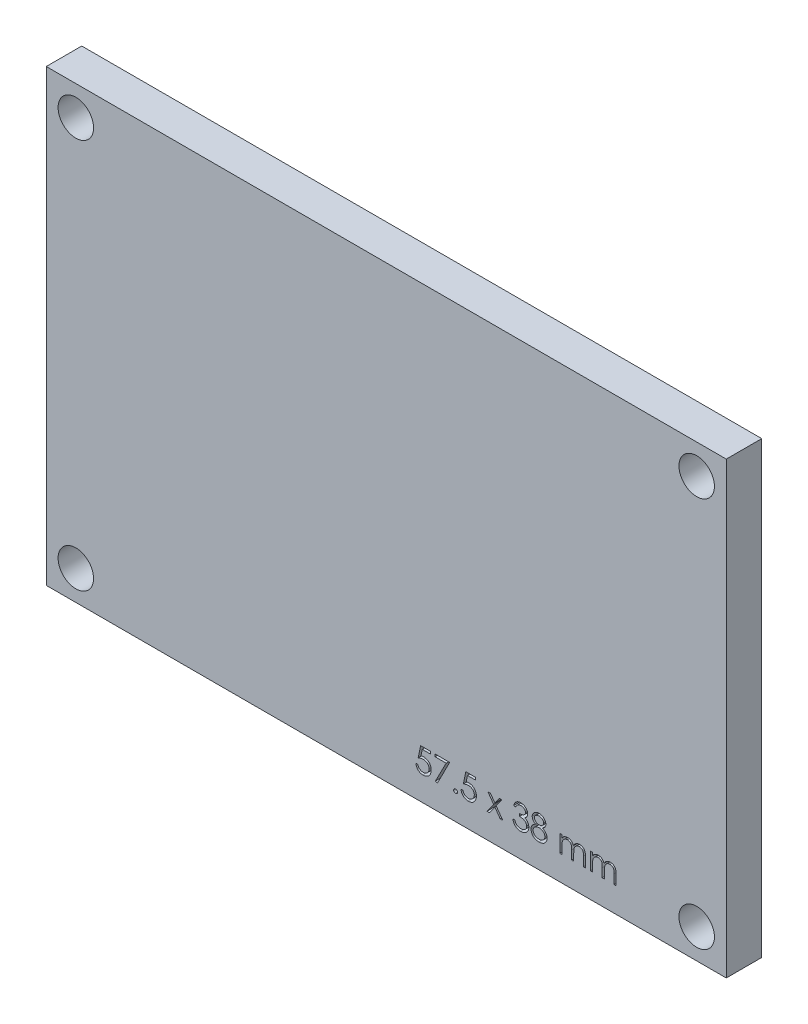
from build123d import *

# Parameters (mm, degrees)
SKETCH1_W               = 57.5
SKETCH1_H               = 38
BOSS_EXTRUDE1_DEPTH     = 3
CUT_EXTRUDE1_DEPTH      = 35.591364529
CUT_EXTRUDE1_DEPTH_BACK = 35.591364529
SKETCH2_R               = 1.5
CUT_EXTRUDE2_DEPTH      = 1


with BuildPart() as part:
    # Sketch1 → Boss-Extrude1 (new body)
    with BuildSketch(Plane.XY):
        Rectangle(SKETCH1_W, SKETCH1_H)
    extrude(amount=BOSS_EXTRUDE1_DEPTH)

    # Sketch2 → Cut-Extrude1 (cut, two sides: drawn at the far end of the back side and taken through both)
    with BuildSketch(Plane.XY.offset(3).offset(-CUT_EXTRUDE1_DEPTH_BACK)):
        with Locations((-26.25, 16.5)):
            Circle(SKETCH2_R)
        with Locations((-26.25, -16.5)):
            Circle(SKETCH2_R)
        with Locations((26.25, 16.5)):
            Circle(SKETCH2_R)
        with Locations((26.25, -16.5)):
            Circle(SKETCH2_R)
    extrude(amount=CUT_EXTRUDE1_DEPTH + CUT_EXTRUDE1_DEPTH_BACK, mode=Mode.SUBTRACT)

    # Sketch4 → Cut-Extrude2 (cut)
    # profile 1 of 9: a face of its own
    with BuildSketch(Plane.XY.offset(3)):
        with BuildLine():
            Line((3.724840793, -14.904911139), (3.724840793, -15.110039344))
            Line((3.724840793, -15.110039344), (3.044552332, -15.110039344))
            Line((3.044552332, -15.110039344), (2.936779896, -15.636081011))
            add(Edge.make_bspline(
                [(2.936779896, -15.636081011), (2.957954681, -15.630235141), (2.998977479, -15.618909693), (3.059525971, -15.606334967), (3.11700723, -15.598754714), (3.154307441, -15.597719679), (3.172356819, -15.597218831)],
                knots=[0, 0, 0, 0, 1.100273476, 2.13160584, 3.095893838, 4, 4, 4, 4], degree=3))
            add(Edge.make_bspline(
                [(3.172356819, -15.597218831), (3.194690384, -15.597702223), (3.238603754, -15.598652692), (3.302854581, -15.607779463), (3.364187663, -15.622145129), (3.422474732, -15.642213998), (3.477823618, -15.667876703), (3.529725081, -15.699933812), (3.578958174, -15.73738143), (3.624639657, -15.780435722), (3.666082118, -15.827819503), (3.702519827, -15.878766858), (3.733469878, -15.932782665), (3.758361738, -15.990383013), (3.778238501, -16.0509311), (3.791468212, -16.115064005), (3.80027776, -16.182177216), (3.801261981, -16.228065542), (3.80176387, -16.251465626)],
                knots=[0, 0, 0, 0, 1.052922333, 2.070308379, 3.05430497, 4.020497103, 4.973039431, 5.925935799, 6.892292201, 7.88610001, 8.88166317, 9.857072816, 10.836096531, 11.812156883, 12.81219415, 13.836441305, 14.89672472, 16, 16, 16, 16], degree=3))
            add(Edge.make_bspline(
                [(3.80176387, -16.251465626), (3.801383827, -16.267764038), (3.800628877, -16.300140602), (3.796789684, -16.348223002), (3.789397846, -16.395287479), (3.779473432, -16.441340274), (3.766592051, -16.486294201), (3.750998306, -16.530277931), (3.731914861, -16.573017706), (3.710982647, -16.614917932), (3.687413231, -16.655031365), (3.661254084, -16.692545071), (3.63361666, -16.728021804), (3.603878726, -16.76108108), (3.571763871, -16.791505661), (3.537661033, -16.819476108), (3.501842337, -16.845465439), (3.463753627, -16.868418694), (3.424243636, -16.889540383), (3.382741798, -16.906868119), (3.340192826, -16.922359849), (3.295984326, -16.934708151), (3.250216433, -16.944383896), (3.202813704, -16.950955668), (3.15402475, -16.955742203), (3.120953314, -16.956041836), (3.104247844, -16.95619319)],
                knots=[0, 0, 0, 0, 1.056347294, 2.098418968, 3.122841568, 4.141288669, 5.149314143, 6.15115421, 7.162517403, 8.180376062, 9.185164535, 10.17417709, 11.141909838, 12.097768115, 13.052685741, 14.0056014, 14.954263652, 15.917497458, 16.885230207, 17.854509472, 18.828990115, 19.81800267, 20.826176721, 21.857883937, 22.917946725, 24, 24, 24, 24], degree=3))
            add(Edge.make_bspline(
                [(3.104247844, -16.95619319), (3.084319741, -16.955798426), (3.045113552, -16.955021773), (2.987673228, -16.946896924), (2.932407739, -16.935260401), (2.879761967, -16.917753961), (2.829264102, -16.895818364), (2.781593978, -16.868094837), (2.735533534, -16.836678206), (2.692955227, -16.799603719), (2.653437448, -16.759080472), (2.6180623, -16.715104677), (2.586557399, -16.668402139), (2.559427258, -16.618746051), (2.536285532, -16.56626689), (2.518105538, -16.510768033), (2.503432193, -16.452539459), (2.497224524, -16.412451739), (2.494071562, -16.392090626)],
                knots=[0, 0, 0, 0, 1.0467383, 2.05933395, 3.04377827, 4.011590433, 4.970194871, 5.932262533, 6.905835911, 7.896367577, 8.894135286, 9.877477877, 10.858688626, 11.851381753, 12.8477658, 13.868841284, 14.917554742, 16, 16, 16, 16], degree=3))
            Line((2.494071562, -16.392090626), (2.673558742, -16.392090626))
            add(Edge.make_bspline(
                [(2.673558742, -16.392090626), (2.67797506, -16.411162885), (2.68646347, -16.447820825), (2.705095326, -16.499324448), (2.727875826, -16.545221147), (2.754964025, -16.586118052), (2.787278329, -16.621780336), (2.824152288, -16.653561515), (2.865493844, -16.682233017), (2.911432832, -16.706131741), (2.959897449, -16.726513886), (3.010621569, -16.740086283), (3.062224053, -16.74962965), (3.097125979, -16.750584942), (3.114664511, -16.751064985)],
                knots=[0, 0, 0, 0, 1.136247022, 2.183929868, 3.172523383, 4.106158343, 5.02341133, 5.958108904, 6.928429099, 7.938127109, 8.96079061, 9.975095812, 10.982467395, 12, 12, 12, 12], degree=3))
            add(Edge.make_bspline(
                [(3.114664511, -16.751064985), (3.131783622, -16.750595969), (3.165491292, -16.749672473), (3.215097799, -16.742564466), (3.26299087, -16.731617282), (3.308697931, -16.715234508), (3.35301881, -16.69532324), (3.394832393, -16.669771769), (3.435348323, -16.640366044), (3.473307257, -16.606676541), (3.508072656, -16.569551001), (3.53879044, -16.529849633), (3.564377247, -16.48749715), (3.585939595, -16.443226777), (3.602312909, -16.396553315), (3.61399347, -16.347695501), (3.62085236, -16.296532655), (3.621795892, -16.261635907), (3.62227669, -16.243853447)],
                knots=[0, 0, 0, 0, 1.027316725, 2.022795036, 3.002884548, 3.971462791, 4.93288096, 5.914575861, 6.907176829, 7.935150275, 8.956128384, 9.956726525, 10.942570165, 11.921478529, 12.907843606, 13.90538589, 14.932640048, 16, 16, 16, 16], degree=3))
            add(Edge.make_bspline(
                [(3.62227669, -16.243853447), (3.621900417, -16.22781016), (3.621163914, -16.196407709), (3.615146445, -16.150465305), (3.604679604, -16.106994996), (3.590151672, -16.065786862), (3.571706239, -16.026802038), (3.549165489, -15.990000289), (3.522106405, -15.95586667), (3.491196754, -15.924385211), (3.457335017, -15.895330997), (3.419938592, -15.870562947), (3.379790063, -15.849726423), (3.337373149, -15.831744709), (3.291678921, -15.818829998), (3.243612274, -15.809134063), (3.192654155, -15.803525285), (3.157813762, -15.802747063), (3.139904896, -15.802347036)],
                knots=[0, 0, 0, 0, 1.045622112, 2.046656509, 3.013763289, 3.955457236, 4.890082067, 5.820317437, 6.762574623, 7.722996705, 8.69280354, 9.665887285, 10.63943826, 11.638615906, 12.663482002, 13.728887084, 14.832589034, 16, 16, 16, 16], degree=3))
            add(Edge.make_bspline(
                [(3.139904896, -15.802347036), (3.124402651, -15.802678803), (3.092394448, -15.803363816), (3.043295689, -15.808407529), (2.991700419, -15.816544268), (2.937806422, -15.82773641), (2.881451846, -15.842382739), (2.822755617, -15.859933882), (2.761594321, -15.880917882), (2.720384193, -15.896764861), (2.699199767, -15.904911139)],
                knots=[0, 0, 0, 0, 0.817624296, 1.688186739, 2.600797293, 3.572016777, 4.590301741, 5.671205678, 6.80286297, 8, 8, 8, 8], degree=3))
            Line((2.699199767, -15.904911139), (2.904327973, -14.904911139))
            Line((2.904327973, -14.904911139), (3.724840793, -14.904911139))
        make_face()
    # profile 2 of 9: a face of its own
    with BuildSketch(Plane.XY.offset(3)):
        Polygon((4.135097203, -14.904911139), (5.365866434, -14.904911139), (4.314584383, -16.95619319), (4.159536306, -16.870856652), (5.062180537, -15.110039344), (4.135097203, -15.110039344), align=None)
    # profile 3 of 9: a face of its own
    with BuildSketch(Plane.XY.offset(3)):
        with BuildLine():
            add(Edge.make_bspline(
                [(5.865866434, -16.597218831), (5.877003698, -16.597880641), (5.898837002, -16.599178041), (5.930402219, -16.608078997), (5.958970596, -16.623883946), (5.984417593, -16.644948391), (6.005392722, -16.67048877), (6.021760923, -16.698829289), (6.030584343, -16.730658771), (6.031872293, -16.752618585), (6.032533101, -16.763885498)],
                knots=[0, 0, 0, 0, 1.020151414, 1.999887582, 2.974338812, 3.990962822, 5.007586832, 5.987933904, 6.967670073, 8, 8, 8, 8], degree=3))
            add(Edge.make_bspline(
                [(6.032533101, -16.763885498), (6.0318499, -16.774881686), (6.030502639, -16.796566008), (6.021781149, -16.828155416), (6.005267977, -16.856513647), (5.984562267, -16.882400583), (5.958964305, -16.903509652), (5.930334678, -16.919180134), (5.898911102, -16.928718409), (5.87701606, -16.929933436), (5.865866434, -16.930552165)],
                knots=[0, 0, 0, 0, 1.009421747, 1.99056486, 2.972319754, 3.999869655, 5.017953583, 5.993804169, 6.978383603, 8, 8, 8, 8], degree=3))
            add(Edge.make_bspline(
                [(5.865866434, -16.930552165), (5.854708774, -16.929955823), (5.832926098, -16.928791609), (5.801619816, -16.918984291), (5.772815833, -16.9036566), (5.747222855, -16.882361223), (5.726343729, -16.856646855), (5.710557796, -16.827960114), (5.701077711, -16.796656436), (5.699830926, -16.774899497), (5.699199767, -16.763885498)],
                knots=[0, 0, 0, 0, 1.022052826, 1.995314843, 2.982371812, 4.00089066, 5.028879526, 6.005146991, 6.990147033, 8, 8, 8, 8], degree=3))
            add(Edge.make_bspline(
                [(5.699199767, -16.763885498), (5.699806681, -16.752600138), (5.700991606, -16.730566858), (5.710577698, -16.699024511), (5.726221247, -16.670356831), (5.747367187, -16.644987357), (5.772809642, -16.62373747), (5.801550331, -16.608271874), (5.833001497, -16.599105924), (5.854721461, -16.597858771), (5.865866434, -16.597218831)],
                knots=[0, 0, 0, 0, 1.032775665, 2.016367738, 2.991239715, 4.008302682, 5.025365648, 6.011011707, 6.979408107, 8, 8, 8, 8], degree=3))
        make_face()
    # profile 4 of 9: a face of its own
    with BuildSketch(Plane.XY.offset(3)):
        with BuildLine():
            Line((7.545353614, -14.904911139), (7.545353614, -15.110039344))
            Line((7.545353614, -15.110039344), (6.865065152, -15.110039344))
            Line((6.865065152, -15.110039344), (6.757292716, -15.636081011))
            add(Edge.make_bspline(
                [(6.757292716, -15.636081011), (6.778467501, -15.630235141), (6.819490299, -15.618909693), (6.880038791, -15.606334967), (6.93752005, -15.598754714), (6.974820262, -15.597719679), (6.992869639, -15.597218831)],
                knots=[0, 0, 0, 0, 1.100273476, 2.13160584, 3.095893838, 4, 4, 4, 4], degree=3))
            add(Edge.make_bspline(
                [(6.992869639, -15.597218831), (7.015203205, -15.597702223), (7.059116575, -15.598652692), (7.123367402, -15.607779463), (7.184700483, -15.622145129), (7.242987552, -15.642213998), (7.298336438, -15.667876703), (7.350237902, -15.699933812), (7.399470995, -15.73738143), (7.445152477, -15.780435722), (7.486594939, -15.827819503), (7.523032647, -15.878766858), (7.553982699, -15.932782665), (7.578874559, -15.990383013), (7.598751321, -16.0509311), (7.611981033, -16.115064005), (7.620790581, -16.182177216), (7.621774801, -16.228065542), (7.62227669, -16.251465626)],
                knots=[0, 0, 0, 0, 1.052922333, 2.070308379, 3.05430497, 4.020497103, 4.973039431, 5.925935799, 6.892292201, 7.88610001, 8.88166317, 9.857072816, 10.836096531, 11.812156883, 12.81219415, 13.836441305, 14.89672472, 16, 16, 16, 16], degree=3))
            add(Edge.make_bspline(
                [(7.62227669, -16.251465626), (7.621896647, -16.267764038), (7.621141697, -16.300140602), (7.617302504, -16.348223002), (7.609910667, -16.395287479), (7.599986253, -16.441340274), (7.587104871, -16.486294201), (7.571511126, -16.530277931), (7.552427682, -16.573017706), (7.531495467, -16.614917932), (7.507926051, -16.655031365), (7.481766904, -16.692545071), (7.454129481, -16.728021804), (7.424391546, -16.76108108), (7.392276692, -16.791505661), (7.358173854, -16.819476108), (7.322355157, -16.845465439), (7.284266447, -16.868418694), (7.244756457, -16.889540383), (7.203254619, -16.906868119), (7.160705647, -16.922359849), (7.116497147, -16.934708151), (7.070729254, -16.944383896), (7.023326525, -16.950955668), (6.97453757, -16.955742203), (6.941466135, -16.956041836), (6.924760665, -16.95619319)],
                knots=[0, 0, 0, 0, 1.056347294, 2.098418968, 3.122841568, 4.141288669, 5.149314143, 6.15115421, 7.162517403, 8.180376062, 9.185164535, 10.17417709, 11.141909838, 12.097768115, 13.052685741, 14.0056014, 14.954263652, 15.917497458, 16.885230207, 17.854509472, 18.828990115, 19.81800267, 20.826176721, 21.857883937, 22.917946725, 24, 24, 24, 24], degree=3))
            add(Edge.make_bspline(
                [(6.924760665, -16.95619319), (6.904832562, -16.955798426), (6.865626373, -16.955021773), (6.808186049, -16.946896924), (6.75292056, -16.935260401), (6.700274788, -16.917753961), (6.649776923, -16.895818364), (6.602106798, -16.868094837), (6.556046355, -16.836678206), (6.513468048, -16.799603719), (6.473950269, -16.759080472), (6.438575121, -16.715104677), (6.40707022, -16.668402139), (6.379940079, -16.618746051), (6.356798352, -16.56626689), (6.338618359, -16.510768033), (6.323945013, -16.452539459), (6.317737344, -16.412451739), (6.314584383, -16.392090626)],
                knots=[0, 0, 0, 0, 1.0467383, 2.05933395, 3.04377827, 4.011590433, 4.970194871, 5.932262533, 6.905835911, 7.896367577, 8.894135286, 9.877477877, 10.858688626, 11.851381753, 12.8477658, 13.868841284, 14.917554742, 16, 16, 16, 16], degree=3))
            Line((6.314584383, -16.392090626), (6.494071562, -16.392090626))
            add(Edge.make_bspline(
                [(6.494071562, -16.392090626), (6.498487881, -16.411162885), (6.50697629, -16.447820825), (6.525608147, -16.499324448), (6.548388647, -16.545221147), (6.575476846, -16.586118052), (6.607791149, -16.621780336), (6.644665109, -16.653561515), (6.686006665, -16.682233017), (6.731945653, -16.706131741), (6.78041027, -16.726513886), (6.83113439, -16.740086283), (6.882736873, -16.74962965), (6.917638799, -16.750584942), (6.935177332, -16.751064985)],
                knots=[0, 0, 0, 0, 1.136247022, 2.183929868, 3.172523383, 4.106158343, 5.02341133, 5.958108904, 6.928429099, 7.938127109, 8.96079061, 9.975095812, 10.982467395, 12, 12, 12, 12], degree=3))
            add(Edge.make_bspline(
                [(6.935177332, -16.751064985), (6.952296443, -16.750595969), (6.986004112, -16.749672473), (7.035610619, -16.742564466), (7.08350369, -16.731617282), (7.129210751, -16.715234508), (7.173531631, -16.69532324), (7.215345214, -16.669771769), (7.255861144, -16.640366044), (7.293820077, -16.606676541), (7.328585477, -16.569551001), (7.35930326, -16.529849633), (7.384890068, -16.48749715), (7.406452416, -16.443226777), (7.422825729, -16.396553315), (7.43450629, -16.347695501), (7.441365181, -16.296532655), (7.442308712, -16.261635907), (7.442789511, -16.243853447)],
                knots=[0, 0, 0, 0, 1.027316725, 2.022795036, 3.002884548, 3.971462791, 4.93288096, 5.914575861, 6.907176829, 7.935150275, 8.956128384, 9.956726525, 10.942570165, 11.921478529, 12.907843606, 13.90538589, 14.932640048, 16, 16, 16, 16], degree=3))
            add(Edge.make_bspline(
                [(7.442789511, -16.243853447), (7.442413237, -16.22781016), (7.441676734, -16.196407709), (7.435659265, -16.150465305), (7.425192424, -16.106994996), (7.410664493, -16.065786862), (7.39221906, -16.026802038), (7.36967831, -15.990000289), (7.342619225, -15.95586667), (7.311709575, -15.924385211), (7.277847837, -15.895330997), (7.240451413, -15.870562947), (7.200302883, -15.849726423), (7.157885969, -15.831744709), (7.112191741, -15.818829998), (7.064125094, -15.809134063), (7.013166975, -15.803525285), (6.978326582, -15.802747063), (6.960417716, -15.802347036)],
                knots=[0, 0, 0, 0, 1.045622112, 2.046656509, 3.013763289, 3.955457236, 4.890082067, 5.820317437, 6.762574623, 7.722996705, 8.69280354, 9.665887285, 10.63943826, 11.638615906, 12.663482002, 13.728887084, 14.832589034, 16, 16, 16, 16], degree=3))
            add(Edge.make_bspline(
                [(6.960417716, -15.802347036), (6.944915471, -15.802678803), (6.912907268, -15.803363816), (6.86380851, -15.808407529), (6.81221324, -15.816544268), (6.758319242, -15.82773641), (6.701964666, -15.842382739), (6.643268437, -15.859933882), (6.582107142, -15.880917882), (6.540897014, -15.896764861), (6.519712588, -15.904911139)],
                knots=[0, 0, 0, 0, 0.817624296, 1.688186739, 2.600797293, 3.572016777, 4.590301741, 5.671205678, 6.80286297, 8, 8, 8, 8], degree=3))
            Line((6.519712588, -15.904911139), (6.724840793, -14.904911139))
            Line((6.724840793, -14.904911139), (7.545353614, -14.904911139))
        make_face()
    # profile 5 of 9: a face of its own
    with BuildSketch(Plane.XY.offset(3)):
        Polygon((8.596635665, -15.443372677), (8.810177332, -15.443372677), (9.186379255, -15.970616267), (9.562581178, -15.443372677), (9.776122844, -15.443372677), (9.293350408, -16.12005537), (9.853045921, -16.904911139), (9.639504255, -16.904911139), (9.186379255, -16.269895113), (8.733254255, -16.904911139), (8.519712588, -16.904911139), (9.079808742, -16.12005537), align=None)
    # profile 6 of 9: a face of its own
    with BuildSketch(Plane.XY.offset(3)):
        with BuildLine():
            Line((10.955610024, -15.3664496), (10.776122844, -15.3664496))
            add(Edge.make_bspline(
                [(10.776122844, -15.3664496), (10.780985445, -15.346316752), (10.790491431, -15.306958681), (10.810318616, -15.250725961), (10.83191819, -15.19751252), (10.857854821, -15.148314764), (10.886145538, -15.102143962), (10.918558522, -15.06004732), (10.953598363, -15.020954196), (10.992355477, -14.986260918), (11.033000426, -14.954845073), (11.076105923, -14.928059326), (11.12080472, -14.905016953), (11.16740651, -14.886033963), (11.216050037, -14.871733664), (11.266295536, -14.861358346), (11.318274679, -14.854620567), (11.353559016, -14.853962988), (11.371475408, -14.853629088)],
                knots=[0, 0, 0, 0, 1.162005537, 2.271625781, 3.343758855, 4.383309926, 5.390229558, 6.379919256, 7.361854164, 8.333198761, 9.295911338, 10.242430842, 11.177959212, 12.116337295, 13.062827104, 14.020064771, 14.994644689, 16, 16, 16, 16], degree=3))
            add(Edge.make_bspline(
                [(11.371475408, -14.853629088), (11.397579832, -14.854417219), (11.449219267, -14.855976291), (11.525083866, -14.870213112), (11.598242048, -14.892741759), (11.667893047, -14.923869603), (11.732589294, -14.962262353), (11.790152829, -15.007956489), (11.839803407, -15.060070375), (11.881457337, -15.117631841), (11.914071622, -15.179149274), (11.938120978, -15.24246365), (11.952761939, -15.307424776), (11.9546594, -15.351286079), (11.955610024, -15.373260498)],
                knots=[0, 0, 0, 0, 1.083050992, 2.142477498, 3.193116406, 4.255571735, 5.30263384, 6.308962982, 7.297363603, 8.282367274, 9.249857812, 10.179914175, 11.08814088, 12, 12, 12, 12], degree=3))
            add(Edge.make_bspline(
                [(11.955610024, -15.373260498), (11.954945115, -15.394407238), (11.953643991, -15.435788126), (11.942596159, -15.49620041), (11.924004009, -15.553138467), (11.898249859, -15.606841989), (11.86491183, -15.656970469), (11.824527432, -15.703636692), (11.776811625, -15.747047639), (11.740652232, -15.77191591), (11.722036306, -15.784718831)],
                knots=[0, 0, 0, 0, 1.024540389, 2.004866551, 2.965041327, 3.920577974, 4.882998113, 5.874504559, 6.905732034, 8, 8, 8, 8], degree=3))
            add(Edge.make_bspline(
                [(11.722036306, -15.784718831), (11.743311594, -15.794992072), (11.785464094, -15.815346334), (11.842921539, -15.855263909), (11.895080325, -15.901353251), (11.924168165, -15.937320481), (11.938783101, -15.955391908)],
                knots=[0, 0, 0, 0, 1.015518401, 2.012035669, 3.001164323, 4, 4, 4, 4], degree=3))
            add(Edge.make_bspline(
                [(11.938783101, -15.955391908), (11.948406725, -15.968567766), (11.96749638, -15.994703719), (11.991059542, -16.036724533), (12.012436179, -16.079211099), (12.029093447, -16.123302188), (12.041992799, -16.168486767), (12.051213389, -16.214842422), (12.05694147, -16.262407006), (12.057761785, -16.294585566), (12.058174126, -16.310760498)],
                knots=[0, 0, 0, 0, 1.025084078, 2.033381695, 3.024893161, 4.013698104, 4.991890475, 5.976764909, 6.982997093, 8, 8, 8, 8], degree=3))
            add(Edge.make_bspline(
                [(12.058174126, -16.310760498), (12.05714869, -16.338766053), (12.055102643, -16.394645368), (12.036814601, -16.477202352), (12.008464177, -16.557902639), (11.968203071, -16.635088261), (11.919135923, -16.707305622), (11.86076031, -16.771920656), (11.793739505, -16.827462715), (11.71899342, -16.87386856), (11.638012203, -16.910964516), (11.551397579, -16.936711626), (11.460397549, -16.953480768), (11.397993379, -16.955278979), (11.366267075, -16.95619319)],
                knots=[0, 0, 0, 0, 0.955779014, 1.907060117, 2.875433937, 3.871313158, 4.872415639, 5.851225146, 6.836215519, 7.83643374, 8.849228613, 9.86973379, 10.916971861, 12, 12, 12, 12], degree=3))
            add(Edge.make_bspline(
                [(11.366267075, -16.95619319), (11.344884618, -16.955697068), (11.302811072, -16.954720866), (11.240957644, -16.94804738), (11.181916673, -16.935858805), (11.125608332, -16.919456916), (11.071982597, -16.898661635), (11.021203108, -16.872765236), (10.972957454, -16.842301521), (10.927700911, -16.806910899), (10.885438872, -16.767321562), (10.847294458, -16.722830699), (10.81263172, -16.674260754), (10.782378783, -16.621047579), (10.755157667, -16.563878861), (10.732768549, -16.502022576), (10.71306251, -16.436031706), (10.703900531, -16.390044426), (10.699199767, -16.3664496)],
                knots=[0, 0, 0, 0, 1.048658725, 2.063410685, 3.046034179, 4.001477787, 4.936774919, 5.862367409, 6.792675028, 7.730719943, 8.675894397, 9.627829632, 10.600096036, 11.597688215, 12.626045268, 13.701542398, 14.82072376, 16, 16, 16, 16], degree=3))
            Line((10.699199767, -16.3664496), (10.878686947, -16.3664496))
            add(Edge.make_bspline(
                [(10.878686947, -16.3664496), (10.883363113, -16.381849037), (10.892458664, -16.411802278), (10.90794112, -16.454911024), (10.925580132, -16.494429911), (10.944502737, -16.530648838), (10.964376135, -16.563924497), (10.986613235, -16.593376993), (11.009567032, -16.620299966), (11.02686952, -16.635468316), (11.035337588, -16.642891908)],
                knots=[0, 0, 0, 0, 1.198163088, 2.33053128, 3.407730985, 4.417276592, 5.372219308, 6.28897303, 7.162600585, 8, 8, 8, 8], degree=3))
            add(Edge.make_bspline(
                [(11.035337588, -16.642891908), (11.046535632, -16.651525242), (11.068897153, -16.66876526), (11.105336142, -16.690766191), (11.143658935, -16.709829634), (11.184695891, -16.724391745), (11.227561474, -16.736721837), (11.27294854, -16.744790705), (11.320456664, -16.750326803), (11.352895386, -16.750815336), (11.369472203, -16.751064985)],
                knots=[0, 0, 0, 0, 0.946170439, 1.889420265, 2.845303464, 3.807233317, 4.801018734, 5.828864929, 6.890507805, 8, 8, 8, 8], degree=3))
            add(Edge.make_bspline(
                [(11.369472203, -16.751064985), (11.388188491, -16.750713039), (11.424786574, -16.750024839), (11.478189351, -16.743695864), (11.528993607, -16.734478485), (11.576635279, -16.720242495), (11.621738426, -16.702653437), (11.663670797, -16.680568634), (11.702982858, -16.654657364), (11.739171089, -16.625206416), (11.771711379, -16.592965562), (11.80036253, -16.559243807), (11.824719479, -16.524183333), (11.844367238, -16.487590121), (11.859881838, -16.449615705), (11.870443667, -16.410153517), (11.87778739, -16.369526507), (11.878385454, -16.341909954), (11.878686947, -16.327988062)],
                knots=[0, 0, 0, 0, 1.217147791, 2.380027433, 3.494444702, 4.572153297, 5.609568379, 6.639424714, 7.649109417, 8.668170816, 9.669597737, 10.625200337, 11.543417969, 12.441394052, 13.322311151, 14.205496177, 15.095365482, 16, 16, 16, 16], degree=3))
            add(Edge.make_bspline(
                [(11.878686947, -16.327988062), (11.877812489, -16.309353011), (11.876067924, -16.272175635), (11.862748736, -16.217479878), (11.840840813, -16.164780786), (11.810170807, -16.114977477), (11.772836105, -16.068819819), (11.729199015, -16.027636115), (11.67889717, -15.993653205), (11.632600102, -15.970173973), (11.591591442, -15.954152787), (11.556496936, -15.943481379), (11.517207448, -15.934445004), (11.474198106, -15.926037992), (11.42714484, -15.918882936), (11.376098875, -15.912916184), (11.321049869, -15.908141875), (11.282940631, -15.906009821), (11.263302332, -15.904911139)],
                knots=[0, 0, 0, 0, 1.07054697, 2.135767047, 3.216561865, 4.33974944, 5.486079747, 6.621378074, 7.775625952, 8.963672916, 9.598146892, 10.304877434, 11.070270905, 11.915000392, 12.823868403, 13.805723172, 14.86925407, 16, 16, 16, 16], degree=3))
            Line((11.263302332, -15.904911139), (11.263302332, -15.699782934))
            add(Edge.make_bspline(
                [(11.263302332, -15.699782934), (11.288045855, -15.699363046), (11.336512339, -15.698540589), (11.407309084, -15.688593154), (11.47500812, -15.674832795), (11.538109115, -15.653755543), (11.595622666, -15.629275373), (11.645519581, -15.600788396), (11.687100808, -15.569122825), (11.720164277, -15.533789906), (11.745038122, -15.495895593), (11.763224864, -15.45640036), (11.773967907, -15.414958039), (11.775402003, -15.386675372), (11.776122844, -15.372459216)],
                knots=[0, 0, 0, 0, 1.321986639, 2.589447074, 3.816329219, 5.01088745, 6.139805852, 7.153945165, 8.075214402, 8.924034688, 9.728124013, 10.488707548, 11.240355623, 12, 12, 12, 12], degree=3))
            add(Edge.make_bspline(
                [(11.776122844, -15.372459216), (11.775886038, -15.36201479), (11.775414923, -15.3412361), (11.769473622, -15.310878918), (11.760545598, -15.281449806), (11.748271467, -15.253073915), (11.731842782, -15.225948044), (11.712182218, -15.19984093), (11.688771875, -15.174901628), (11.661945906, -15.151655731), (11.63313916, -15.129501881), (11.60156786, -15.110694089), (11.568183932, -15.094611196), (11.532950415, -15.081348623), (11.495752969, -15.071371887), (11.456766364, -15.064208549), (11.415916259, -15.059729889), (11.388046698, -15.05908508), (11.373879255, -15.058757293)],
                knots=[0, 0, 0, 0, 0.884392785, 1.759457502, 2.611959086, 3.489218968, 4.37281399, 5.2945488, 6.255912374, 7.266815255, 8.301784654, 9.332968512, 10.37626691, 11.440494194, 12.520033166, 13.637162961, 14.798855837, 16, 16, 16, 16], degree=3))
            add(Edge.make_bspline(
                [(11.373879255, -15.058757293), (11.351106873, -15.059552357), (11.306627115, -15.061105302), (11.242504305, -15.074707024), (11.182893257, -15.096408786), (11.137328305, -15.122313368), (11.10368112, -15.147885045), (11.079637155, -15.170217837), (11.056025435, -15.195036593), (11.034399334, -15.223869951), (11.01252849, -15.254765259), (10.992617312, -15.289293077), (10.973268916, -15.326552731), (10.961610317, -15.352893094), (10.955610024, -15.3664496)],
                knots=[0, 0, 0, 0, 1.472543308, 2.876219568, 4.221790263, 5.565193594, 6.249813518, 6.953379497, 7.687249741, 8.463570142, 9.283606569, 10.136032583, 11.040678096, 12, 12, 12, 12], degree=3))
        make_face()
    # profile 7 of 9: a face of its own
    with BuildSketch(Plane.XY.offset(3)):
        with BuildLine():
            add(Edge.make_bspline(
                [(13.210017075, -15.790728447), (13.226387673, -15.799264421), (13.258315808, -15.815912423), (13.303788498, -15.84271861), (13.345345642, -15.87097059), (13.384140248, -15.899333939), (13.419490734, -15.928894882), (13.451001827, -15.959770971), (13.479451896, -15.991191512), (13.504267201, -16.023688563), (13.526093965, -16.057175791), (13.544958042, -16.09174109), (13.561082158, -16.127308709), (13.57386098, -16.164266898), (13.584387718, -16.202072762), (13.591630921, -16.241214466), (13.595526303, -16.281434089), (13.596262768, -16.308615976), (13.596635665, -16.322379088)],
                knots=[0, 0, 0, 0, 1.272397273, 2.481599622, 3.635517121, 4.734568067, 5.792894095, 6.808321871, 7.773003508, 8.711915296, 9.623354172, 10.525449501, 11.423591555, 12.311487226, 13.218079475, 14.126165749, 15.051214107, 16, 16, 16, 16], degree=3))
            add(Edge.make_bspline(
                [(13.596635665, -16.322379088), (13.596194853, -16.341634935), (13.595322321, -16.379749482), (13.58772233, -16.436004402), (13.576343486, -16.490639706), (13.559726621, -16.543643415), (13.538176112, -16.594723057), (13.51161792, -16.643922356), (13.481554375, -16.692047676), (13.457410238, -16.721658763), (13.445193357, -16.736641908)],
                knots=[0, 0, 0, 0, 1.025265484, 2.029385089, 3.018602448, 3.995076438, 4.983346944, 5.966715145, 6.97116228, 8, 8, 8, 8], degree=3))
            add(Edge.make_bspline(
                [(13.445193357, -16.736641908), (13.4292868, -16.754124065), (13.397670249, -16.788872346), (13.343508576, -16.833987095), (13.284067499, -16.871901034), (13.219577023, -16.90279926), (13.150209537, -16.926848322), (13.07597982, -16.944129761), (12.996743161, -16.954028292), (12.942282892, -16.955459143), (12.914343998, -16.95619319)],
                knots=[0, 0, 0, 0, 0.954267603, 1.896743057, 2.838368354, 3.796610408, 4.779680527, 5.799409237, 6.871065594, 8, 8, 8, 8], degree=3))
            add(Edge.make_bspline(
                [(12.914343998, -16.95619319), (12.887479205, -16.955534631), (12.835203045, -16.954253143), (12.75911283, -16.94557061), (12.688185361, -16.930354687), (12.622008236, -16.909529196), (12.560980412, -16.882437637), (12.505275782, -16.848718546), (12.454090655, -16.80972915), (12.408978385, -16.764349677), (12.368927845, -16.715745179), (12.333746101, -16.665601402), (12.30450377, -16.613913769), (12.27974543, -16.561452987), (12.260792274, -16.507483757), (12.247665297, -16.452283749), (12.239328546, -16.395949382), (12.238219326, -16.357931294), (12.237661306, -16.33880537)],
                knots=[0, 0, 0, 0, 1.256902934, 2.445805442, 3.576955095, 4.645999104, 5.686449165, 6.692658513, 7.68621702, 8.689161843, 9.678783111, 10.630372946, 11.551080876, 12.453998257, 13.34127905, 14.221779781, 15.105423033, 16, 16, 16, 16], degree=3))
            add(Edge.make_bspline(
                [(12.237661306, -16.33880537), (12.237991524, -16.324771546), (12.23864415, -16.297035756), (12.243161207, -16.256058997), (12.250423184, -16.216175491), (12.260285731, -16.177237924), (12.273652032, -16.139529768), (12.289790394, -16.102872354), (12.308608652, -16.067224298), (12.330369318, -16.032390651), (12.35568476, -15.998859502), (12.384349703, -15.96606179), (12.416937057, -15.934506438), (12.45308429, -15.903807909), (12.492378313, -15.873421639), (12.535839759, -15.844989794), (12.582316483, -15.816499528), (12.615348144, -15.799466199), (12.632292716, -15.790728447)],
                knots=[0, 0, 0, 0, 0.941657376, 1.861047343, 2.762797495, 3.66048619, 4.553285746, 5.444104102, 6.34607688, 7.256116206, 8.197091036, 9.162375105, 10.176350973, 11.237807142, 12.343728897, 13.50695164, 14.721116704, 16, 16, 16, 16], degree=3))
            add(Edge.make_bspline(
                [(12.632292716, -15.790728447), (12.609097645, -15.778080007), (12.564185495, -15.753589089), (12.504717243, -15.708590914), (12.453636886, -15.65985502), (12.412348476, -15.60635228), (12.37985006, -15.549754066), (12.357553715, -15.490414493), (12.34247001, -15.429433857), (12.340975823, -15.387773173), (12.340225408, -15.366850242)],
                knots=[0, 0, 0, 0, 1.166880483, 2.259407225, 3.286803203, 4.280235371, 5.237608625, 6.161067461, 7.076446754, 8, 8, 8, 8], degree=3))
            add(Edge.make_bspline(
                [(12.340225408, -15.366850242), (12.341159936, -15.345537351), (12.343038501, -15.302694724), (12.35822897, -15.238919797), (12.382983293, -15.176281759), (12.416652435, -15.115084209), (12.458587987, -15.057398372), (12.508900299, -15.005660689), (12.566387897, -14.960339842), (12.630763821, -14.922296314), (12.70004167, -14.891334224), (12.773136369, -14.869975125), (12.848774365, -14.85601163), (12.900258776, -14.854430684), (12.926363229, -14.853629088)],
                knots=[0, 0, 0, 0, 0.888701115, 1.786444228, 2.72001202, 3.692817113, 4.693886446, 5.687152267, 6.695133018, 7.739871481, 8.800368666, 9.853104506, 10.91144658, 12, 12, 12, 12], degree=3))
            add(Edge.make_bspline(
                [(12.926363229, -14.853629088), (12.95179398, -14.854455569), (13.001940525, -14.856085297), (13.075651741, -14.869677799), (13.146180242, -14.892380382), (13.213282813, -14.923178795), (13.275758166, -14.96111419), (13.330959485, -15.007057546), (13.379720961, -15.058567004), (13.4200549, -15.116235349), (13.453290837, -15.177197745), (13.476434209, -15.240982043), (13.491263909, -15.306210076), (13.493134402, -15.350346079), (13.494071562, -15.372459216)],
                knots=[0, 0, 0, 0, 1.072916533, 2.115669174, 3.151510826, 4.193348718, 5.225979165, 6.227137561, 7.216255879, 8.211077061, 9.189680878, 10.138522389, 11.067357538, 12, 12, 12, 12], degree=3))
            add(Edge.make_bspline(
                [(13.494071562, -15.372459216), (13.493251813, -15.394160167), (13.491641873, -15.436779601), (13.47809905, -15.498909041), (13.455291443, -15.557093063), (13.424151921, -15.611991893), (13.383565928, -15.662609892), (13.334075224, -15.709590731), (13.276074379, -15.753320348), (13.23249673, -15.77799827), (13.210017075, -15.790728447)],
                knots=[0, 0, 0, 0, 0.975232327, 1.915300861, 2.843280834, 3.77672583, 4.742871857, 5.749627742, 6.839139064, 8, 8, 8, 8], degree=3))
        make_face()
        with BuildLine():
            add(Edge.make_bspline(
                [(12.916347203, -15.058757293), (12.902318171, -15.059129545), (12.874871251, -15.059857832), (12.834626296, -15.063662767), (12.796356372, -15.071064605), (12.759661628, -15.080915298), (12.725045164, -15.094222719), (12.692036847, -15.10987701), (12.661198453, -15.128909048), (12.632157709, -15.150258304), (12.606014409, -15.173739964), (12.582811808, -15.198204947), (12.5635386, -15.224133742), (12.547172252, -15.250881376), (12.535297099, -15.279241705), (12.526403211, -15.308345235), (12.520390987, -15.33855974), (12.519940479, -15.359209175), (12.519712588, -15.369654729)],
                knots=[0, 0, 0, 0, 1.203892937, 2.355340988, 3.463153438, 4.544400666, 5.610487187, 6.640501085, 7.674077295, 8.714426146, 9.728707835, 10.68524104, 11.601827946, 12.495867327, 13.368432065, 14.231010473, 15.105153427, 16, 16, 16, 16], degree=3))
            add(Edge.make_bspline(
                [(12.519712588, -15.369654729), (12.520105369, -15.380100734), (12.520881561, -15.400743542), (12.526884491, -15.431226894), (12.535831265, -15.461182115), (12.549917358, -15.489896921), (12.566812419, -15.518367412), (12.587664692, -15.545882032), (12.612515565, -15.572536538), (12.640531245, -15.598104219), (12.671052124, -15.622046369), (12.703385863, -15.642831044), (12.737126658, -15.660221964), (12.77192784, -15.67469591), (12.808144096, -15.685947303), (12.845553509, -15.693929386), (12.884162368, -15.698890528), (12.910322699, -15.699483111), (12.923558742, -15.699782934)],
                knots=[0, 0, 0, 0, 0.873023192, 1.725219244, 2.590779336, 3.480155217, 4.391973325, 5.357036234, 6.360879153, 7.436073238, 8.526419356, 9.601555421, 10.645666583, 11.697338044, 12.750135903, 13.812665442, 14.89329948, 16, 16, 16, 16], degree=3))
            add(Edge.make_bspline(
                [(12.923558742, -15.699782934), (12.940558801, -15.699284153), (12.974391011, -15.698291517), (13.024264915, -15.689062274), (13.072757855, -15.674544607), (13.119351514, -15.654681769), (13.162839849, -15.629751564), (13.201605602, -15.599904125), (13.235318112, -15.565828641), (13.263627032, -15.528055592), (13.285575516, -15.487854684), (13.302662263, -15.44751166), (13.312640101, -15.406596099), (13.313941567, -15.379186405), (13.314584383, -15.365648318)],
                knots=[0, 0, 0, 0, 1.076279235, 2.141928126, 3.20205304, 4.278698113, 5.344010996, 6.36967002, 7.368914609, 8.37248503, 9.349703398, 10.264243087, 11.142681841, 12, 12, 12, 12], degree=3))
            add(Edge.make_bspline(
                [(13.314584383, -15.365648318), (13.314280441, -15.356146584), (13.313677161, -15.337287002), (13.308705701, -15.309436507), (13.300490939, -15.282219603), (13.289369179, -15.255411448), (13.27473501, -15.229388172), (13.257384046, -15.203740694), (13.236307188, -15.179045971), (13.212652083, -15.154728515), (13.185826136, -15.132223359), (13.155881043, -15.112432096), (13.122970328, -15.095625035), (13.087093214, -15.081974318), (13.048381829, -15.071721547), (13.007014472, -15.064043634), (12.962646217, -15.059716141), (12.93211493, -15.059083841), (12.916347203, -15.058757293)],
                knots=[0, 0, 0, 0, 0.814439003, 1.616544685, 2.417341072, 3.248991801, 4.09997495, 4.973547432, 5.9003056, 6.880240646, 7.880314356, 8.896779544, 9.951930927, 11.043077905, 12.18215768, 13.381699519, 14.647792085, 16, 16, 16, 16], degree=3))
        make_face(mode=Mode.SUBTRACT)
        with BuildLine():
            add(Edge.make_bspline(
                [(12.927965793, -15.904911139), (12.91017963, -15.905227505), (12.875287518, -15.905848139), (12.824169273, -15.912756425), (12.775110321, -15.922373221), (12.728276072, -15.936962272), (12.683686302, -15.955931695), (12.641099626, -15.978751432), (12.600841838, -16.005725971), (12.563468852, -16.036512608), (12.529341235, -16.069689439), (12.499399349, -16.104810659), (12.473972195, -16.141223535), (12.453496051, -16.179390523), (12.436689347, -16.218503444), (12.425652846, -16.259536355), (12.418577582, -16.30170042), (12.417627507, -16.330363333), (12.417148485, -16.344814985)],
                knots=[0, 0, 0, 0, 1.140299081, 2.23698856, 3.303958914, 4.344563908, 5.37730929, 6.408454204, 7.439741482, 8.480804886, 9.510774543, 10.48932336, 11.43758569, 12.353841022, 13.263987381, 14.161954604, 15.073269652, 16, 16, 16, 16], degree=3))
            add(Edge.make_bspline(
                [(12.417148485, -16.344814985), (12.41792749, -16.362775503), (12.419473018, -16.398408751), (12.431733955, -16.451073363), (12.451411403, -16.502056823), (12.478854384, -16.550943653), (12.512835854, -16.596629428), (12.554622407, -16.636451585), (12.601617172, -16.671835287), (12.655410231, -16.700452735), (12.714169354, -16.723306938), (12.777878914, -16.739053202), (12.845624582, -16.749476888), (12.892401492, -16.750527277), (12.916347203, -16.751064985)],
                knots=[0, 0, 0, 0, 0.898778495, 1.783155532, 2.693654817, 3.627872908, 4.583023416, 5.533784346, 6.509005473, 7.520592997, 8.575161974, 9.658835044, 10.801527049, 12, 12, 12, 12], degree=3))
            add(Edge.make_bspline(
                [(12.916347203, -16.751064985), (12.935061699, -16.750705666), (12.971523539, -16.750005597), (13.024715509, -16.743826), (13.074912394, -16.734026215), (13.122016851, -16.71977276), (13.166556188, -16.702372774), (13.207775247, -16.679988727), (13.246734405, -16.654530257), (13.281513904, -16.624325596), (13.313190023, -16.592051599), (13.340809048, -16.55788586), (13.364784791, -16.522756927), (13.38360248, -16.485870936), (13.398646054, -16.447935556), (13.409459514, -16.408600978), (13.416131637, -16.367746559), (13.416806434, -16.340032804), (13.417148485, -16.325984857)],
                knots=[0, 0, 0, 0, 1.224942928, 2.386581632, 3.501229538, 4.569074225, 5.605009692, 6.626002462, 7.634866581, 8.645888296, 9.63523824, 10.59253846, 11.518950513, 12.414518923, 13.29783783, 14.186679152, 15.080837789, 16, 16, 16, 16], degree=3))
            add(Edge.make_bspline(
                [(13.417148485, -16.325984857), (13.416630858, -16.312340662), (13.415610186, -16.285436694), (13.409132077, -16.245570107), (13.397751576, -16.207054213), (13.38213592, -16.169425639), (13.361346799, -16.13344681), (13.336864016, -16.098180426), (13.307324519, -16.064605315), (13.273945893, -16.032460688), (13.237569344, -16.00273741), (13.198902404, -15.976443445), (13.158242712, -15.954299379), (13.115676305, -15.936289953), (13.071297702, -15.922125685), (13.025139543, -15.91223083), (12.977147786, -15.906002486), (12.944545003, -15.905279031), (12.927965793, -15.904911139)],
                knots=[0, 0, 0, 0, 0.917430815, 1.809013306, 2.70690318, 3.612392954, 4.541220862, 5.495268465, 6.494511384, 7.542276156, 8.608045339, 9.649016899, 10.681629292, 11.715607085, 12.752076957, 13.808767841, 14.885711793, 16, 16, 16, 16], degree=3))
        make_face(mode=Mode.SUBTRACT)
    # profile 8 of 9: a face of its own
    with BuildSketch(Plane.XY.offset(3)):
        with BuildLine():
            Line((14.673558742, -15.443372677), (14.853045921, -15.443372677))
            Line((14.853045921, -15.443372677), (14.853045921, -15.697379088))
            add(Edge.make_bspline(
                [(14.853045921, -15.697379088), (14.869208178, -15.675157601), (14.900176612, -15.632579102), (14.950956985, -15.576470368), (15.001686192, -15.52885428), (15.038219553, -15.503858353), (15.05577028, -15.491850242)],
                knots=[0, 0, 0, 0, 1.134379233, 2.173579362, 3.122582517, 4, 4, 4, 4], degree=3))
            add(Edge.make_bspline(
                [(15.05577028, -15.491850242), (15.079692944, -15.480418604), (15.127120316, -15.457755054), (15.202217016, -15.434764449), (15.279059684, -15.420635819), (15.330950092, -15.418703606), (15.357052332, -15.417731652)],
                knots=[0, 0, 0, 0, 1.014936303, 2.012140481, 3.000054389, 4, 4, 4, 4], degree=3))
            add(Edge.make_bspline(
                [(15.357052332, -15.417731652), (15.374705472, -15.418328961), (15.409640089, -15.419511003), (15.461402426, -15.427202452), (15.511607347, -15.440497408), (15.559958221, -15.459015879), (15.605512895, -15.481442557), (15.647278151, -15.507756676), (15.684777698, -15.537297862), (15.717992585, -15.571400109), (15.747860599, -15.611021023), (15.775334226, -15.657229165), (15.800720062, -15.711062114), (15.814789381, -15.750128709), (15.822196562, -15.770696395)],
                knots=[0, 0, 0, 0, 1.009824226, 1.998387844, 2.986035974, 3.974953746, 4.955485308, 5.885931332, 6.793869504, 7.679848016, 8.601185859, 9.625726857, 10.749998409, 12, 12, 12, 12], degree=3))
            add(Edge.make_bspline(
                [(15.822196562, -15.770696395), (15.830031563, -15.756568156), (15.845449744, -15.728765764), (15.87133868, -15.689418186), (15.898463135, -15.652614305), (15.927054274, -15.61832492), (15.957011181, -15.586719359), (15.988474838, -15.55769313), (16.021266142, -15.531121579), (16.066861707, -15.500079774), (16.126183197, -15.46710767), (16.200976406, -15.438519988), (16.278776504, -15.420853629), (16.331586617, -15.418779187), (16.358254255, -15.417731652)],
                knots=[0, 0, 0, 0, 0.86119277, 1.694706429, 2.50939023, 3.298075842, 4.073795165, 4.829715201, 5.57930267, 6.321991688, 7.768977793, 9.186738141, 10.579381044, 12, 12, 12, 12], degree=3))
            add(Edge.make_bspline(
                [(16.358254255, -15.417731652), (16.382757948, -15.418655778), (16.430714054, -15.420464383), (16.500529634, -15.434666367), (16.565639238, -15.459053594), (16.625911852, -15.492329958), (16.680288889, -15.534146634), (16.727555351, -15.583900256), (16.76742413, -15.641238898), (16.793469067, -15.695177177), (16.811134932, -15.742797367), (16.822027066, -15.783372391), (16.831649749, -15.828030421), (16.839639032, -15.876824856), (16.845478205, -15.929928061), (16.849804328, -15.987253133), (16.85273237, -16.048844625), (16.852939268, -16.091339197), (16.853045921, -16.113244472)],
                knots=[0, 0, 0, 0, 1.209669288, 2.367440248, 3.500751976, 4.631527125, 5.755587489, 6.87532382, 8.007944318, 9.190864318, 9.82315674, 10.514484317, 11.263564316, 12.079023757, 12.955305781, 13.901327259, 14.918167583, 16, 16, 16, 16], degree=3))
            Line((16.853045921, -16.113244472), (16.853045921, -16.904911139))
            Line((16.853045921, -16.904911139), (16.673558742, -16.904911139))
            Line((16.673558742, -16.904911139), (16.673558742, -16.11244319))
            add(Edge.make_bspline(
                [(16.673558742, -16.11244319), (16.673514237, -16.093745719), (16.673428706, -16.057812024), (16.671889488, -16.006239195), (16.668989309, -15.959228705), (16.665598087, -15.916844655), (16.660887338, -15.878988204), (16.654803949, -15.845735393), (16.64835956, -15.816824644), (16.63765328, -15.784775474), (16.620540199, -15.749421068), (16.594473067, -15.71129331), (16.561633007, -15.678104282), (16.523712917, -15.649293815), (16.480542377, -15.625868877), (16.432962535, -15.609139729), (16.381268792, -15.598783798), (16.345484341, -15.597751789), (16.327004255, -15.597218831)],
                knots=[0, 0, 0, 0, 1.253487763, 2.409012846, 3.458416907, 4.410876679, 5.259312806, 6.014470957, 6.676830364, 7.243083969, 8.276244668, 9.299465089, 10.325150304, 11.392391894, 12.482080715, 13.603491619, 14.762376348, 16, 16, 16, 16], degree=3))
            add(Edge.make_bspline(
                [(16.327004255, -15.597218831), (16.304335709, -15.598028064), (16.259534046, -15.599627416), (16.194136625, -15.615955343), (16.131296044, -15.640572629), (16.072887397, -15.676248319), (16.019157231, -15.718995955), (15.9729289, -15.769824296), (15.93473908, -15.827327111), (15.908879665, -15.880553798), (15.892542922, -15.928364909), (15.881756113, -15.970134836), (15.873365603, -16.017610018), (15.865496729, -16.070471441), (15.860360885, -16.129082973), (15.855693244, -16.193173487), (15.853509893, -16.26293575), (15.853204488, -16.311293858), (15.853045921, -16.336401524)],
                knots=[0, 0, 0, 0, 1.090531906, 2.155305635, 3.229839962, 4.33261226, 5.44038871, 6.529323825, 7.629011124, 8.757537029, 9.370236727, 10.061839251, 10.834451254, 11.692844982, 12.636905849, 13.66920014, 14.789842145, 16, 16, 16, 16], degree=3))
            Line((15.853045921, -16.336401524), (15.853045921, -16.904911139))
            Line((15.853045921, -16.904911139), (15.673558742, -16.904911139))
            Line((15.673558742, -16.904911139), (15.673558742, -16.161722036))
            add(Edge.make_bspline(
                [(15.673558742, -16.161722036), (15.673513353, -16.140754426), (15.673426029, -16.10041485), (15.671896704, -16.042567036), (15.668990063, -15.989949276), (15.66562975, -15.942622725), (15.660795362, -15.900673394), (15.65530407, -15.86387639), (15.648819149, -15.83232396), (15.638082072, -15.797716312), (15.621673805, -15.75959007), (15.595280512, -15.718938058), (15.562361895, -15.683356288), (15.523749966, -15.65297986), (15.480318147, -15.627870442), (15.432327633, -15.609779156), (15.38021054, -15.59925099), (15.344280422, -15.597908992), (15.325802332, -15.597218831)],
                knots=[0, 0, 0, 0, 1.320475261, 2.540461679, 3.643808994, 4.639130445, 5.527981419, 6.302341397, 6.981980563, 7.553956391, 8.582137848, 9.585246428, 10.591171744, 11.620968678, 12.668337649, 13.738356861, 14.836885341, 16, 16, 16, 16], degree=3))
            add(Edge.make_bspline(
                [(15.325802332, -15.597218831), (15.304078782, -15.59809338), (15.26078452, -15.599836324), (15.197183394, -15.615524481), (15.135763003, -15.640098238), (15.077503176, -15.674189563), (15.023975091, -15.716417608), (14.977113224, -15.766083262), (14.937717495, -15.822568424), (14.911585029, -15.875233862), (14.894728758, -15.921847162), (14.883531424, -15.961476275), (14.873908781, -16.005476417), (14.866757911, -16.053983338), (14.859854817, -16.106681106), (14.856523212, -16.163832243), (14.853282319, -16.225387722), (14.853126653, -16.267886319), (14.853045921, -16.289927165)],
                knots=[0, 0, 0, 0, 1.098833095, 2.189935336, 3.297829714, 4.440610912, 5.596351641, 6.740013378, 7.886572111, 9.072425424, 9.705826452, 10.395263256, 11.156850408, 11.985370555, 12.878090359, 13.847760091, 14.883794034, 16, 16, 16, 16], degree=3))
            Line((14.853045921, -16.289927165), (14.853045921, -16.904911139))
            Line((14.853045921, -16.904911139), (14.673558742, -16.904911139))
            Line((14.673558742, -16.904911139), (14.673558742, -15.443372677))
        make_face()
    # profile 9 of 9: a face of its own
    with BuildSketch(Plane.XY.offset(3)):
        with BuildLine():
            Line((17.263302332, -15.443372677), (17.442789511, -15.443372677))
            Line((17.442789511, -15.443372677), (17.442789511, -15.697379088))
            add(Edge.make_bspline(
                [(17.442789511, -15.697379088), (17.458951768, -15.675157601), (17.489920202, -15.632579102), (17.540700575, -15.576470368), (17.591429782, -15.52885428), (17.627963143, -15.503858353), (17.64551387, -15.491850242)],
                knots=[0, 0, 0, 0, 1.134379233, 2.173579362, 3.122582517, 4, 4, 4, 4], degree=3))
            add(Edge.make_bspline(
                [(17.64551387, -15.491850242), (17.669436534, -15.480418604), (17.716863905, -15.457755054), (17.791960605, -15.434764449), (17.868803274, -15.420635819), (17.920693682, -15.418703606), (17.946795921, -15.417731652)],
                knots=[0, 0, 0, 0, 1.014936303, 2.012140481, 3.000054389, 4, 4, 4, 4], degree=3))
            add(Edge.make_bspline(
                [(17.946795921, -15.417731652), (17.964449062, -15.418328961), (17.999383679, -15.419511003), (18.051146016, -15.427202452), (18.101350937, -15.440497408), (18.149701811, -15.459015879), (18.195256485, -15.481442557), (18.237021741, -15.507756676), (18.274521288, -15.537297862), (18.307736175, -15.571400109), (18.337604189, -15.611021023), (18.365077816, -15.657229165), (18.390463651, -15.711062114), (18.404532971, -15.750128709), (18.411940152, -15.770696395)],
                knots=[0, 0, 0, 0, 1.009824226, 1.998387844, 2.986035974, 3.974953746, 4.955485308, 5.885931332, 6.793869504, 7.679848016, 8.601185859, 9.625726857, 10.749998409, 12, 12, 12, 12], degree=3))
            add(Edge.make_bspline(
                [(18.411940152, -15.770696395), (18.419775153, -15.756568156), (18.435193334, -15.728765764), (18.461082269, -15.689418186), (18.488206725, -15.652614305), (18.516797864, -15.61832492), (18.54675477, -15.586719359), (18.578218428, -15.55769313), (18.611009731, -15.531121579), (18.656605297, -15.500079774), (18.715926787, -15.46710767), (18.790719995, -15.438519988), (18.868520093, -15.420853629), (18.921330207, -15.418779187), (18.947997844, -15.417731652)],
                knots=[0, 0, 0, 0, 0.86119277, 1.694706429, 2.50939023, 3.298075842, 4.073795165, 4.829715201, 5.57930267, 6.321991688, 7.768977793, 9.186738141, 10.579381044, 12, 12, 12, 12], degree=3))
            add(Edge.make_bspline(
                [(18.947997844, -15.417731652), (18.972501537, -15.418655778), (19.020457644, -15.420464383), (19.090273224, -15.434666367), (19.155382827, -15.459053594), (19.215655442, -15.492329958), (19.270032478, -15.534146634), (19.317298941, -15.583900256), (19.35716772, -15.641238898), (19.383212657, -15.695177177), (19.400878522, -15.742797367), (19.411770656, -15.783372391), (19.421393339, -15.828030421), (19.429382622, -15.876824856), (19.435221795, -15.929928061), (19.439547918, -15.987253133), (19.44247596, -16.048844625), (19.442682858, -16.091339197), (19.442789511, -16.113244472)],
                knots=[0, 0, 0, 0, 1.209669288, 2.367440248, 3.500751976, 4.631527125, 5.755587489, 6.87532382, 8.007944318, 9.190864318, 9.82315674, 10.514484317, 11.263564316, 12.079023757, 12.955305781, 13.901327259, 14.918167583, 16, 16, 16, 16], degree=3))
            Line((19.442789511, -16.113244472), (19.442789511, -16.904911139))
            Line((19.442789511, -16.904911139), (19.263302332, -16.904911139))
            Line((19.263302332, -16.904911139), (19.263302332, -16.11244319))
            add(Edge.make_bspline(
                [(19.263302332, -16.11244319), (19.263257827, -16.093745719), (19.263172296, -16.057812024), (19.261633078, -16.006239195), (19.258732898, -15.959228705), (19.255341676, -15.916844655), (19.250630928, -15.878988204), (19.244547539, -15.845735393), (19.23810315, -15.816824644), (19.227396869, -15.784775474), (19.210283788, -15.749421068), (19.184216657, -15.71129331), (19.151376596, -15.678104282), (19.113456507, -15.649293815), (19.070285967, -15.625868877), (19.022706125, -15.609139729), (18.971012381, -15.598783798), (18.935227931, -15.597751789), (18.916747844, -15.597218831)],
                knots=[0, 0, 0, 0, 1.253487763, 2.409012846, 3.458416907, 4.410876679, 5.259312806, 6.014470957, 6.676830364, 7.243083969, 8.276244668, 9.299465089, 10.325150304, 11.392391894, 12.482080715, 13.603491619, 14.762376348, 16, 16, 16, 16], degree=3))
            add(Edge.make_bspline(
                [(18.916747844, -15.597218831), (18.894079299, -15.598028064), (18.849277635, -15.599627416), (18.783880215, -15.615955343), (18.721039634, -15.640572629), (18.662630986, -15.676248319), (18.60890082, -15.718995955), (18.56267249, -15.769824296), (18.52448267, -15.827327111), (18.498623255, -15.880553798), (18.482286511, -15.928364909), (18.471499702, -15.970134836), (18.463109193, -16.017610018), (18.455240319, -16.070471441), (18.450104475, -16.129082973), (18.445436833, -16.193173487), (18.443253483, -16.26293575), (18.442948078, -16.311293858), (18.442789511, -16.336401524)],
                knots=[0, 0, 0, 0, 1.090531906, 2.155305635, 3.229839962, 4.33261226, 5.44038871, 6.529323825, 7.629011124, 8.757537029, 9.370236727, 10.061839251, 10.834451254, 11.692844982, 12.636905849, 13.66920014, 14.789842145, 16, 16, 16, 16], degree=3))
            Line((18.442789511, -16.336401524), (18.442789511, -16.904911139))
            Line((18.442789511, -16.904911139), (18.263302332, -16.904911139))
            Line((18.263302332, -16.904911139), (18.263302332, -16.161722036))
            add(Edge.make_bspline(
                [(18.263302332, -16.161722036), (18.263256942, -16.140754426), (18.263169618, -16.10041485), (18.261640294, -16.042567036), (18.258733653, -15.989949276), (18.25537334, -15.942622725), (18.250538952, -15.900673394), (18.245047659, -15.86387639), (18.238562739, -15.83232396), (18.227825662, -15.797716312), (18.211417395, -15.75959007), (18.185024102, -15.718938058), (18.152105485, -15.683356288), (18.113493556, -15.65297986), (18.070061737, -15.627870442), (18.022071222, -15.609779156), (17.969954129, -15.59925099), (17.934024012, -15.597908992), (17.915545921, -15.597218831)],
                knots=[0, 0, 0, 0, 1.320475261, 2.540461679, 3.643808994, 4.639130445, 5.527981419, 6.302341397, 6.981980563, 7.553956391, 8.582137848, 9.585246428, 10.591171744, 11.620968678, 12.668337649, 13.738356861, 14.836885341, 16, 16, 16, 16], degree=3))
            add(Edge.make_bspline(
                [(17.915545921, -15.597218831), (17.893822372, -15.59809338), (17.850528109, -15.599836324), (17.786926984, -15.615524481), (17.725506593, -15.640098238), (17.667246765, -15.674189563), (17.613718681, -15.716417608), (17.566856814, -15.766083262), (17.527461085, -15.822568424), (17.501328619, -15.875233862), (17.484472348, -15.921847162), (17.473275014, -15.961476275), (17.463652371, -16.005476417), (17.456501501, -16.053983338), (17.449598406, -16.106681106), (17.446266801, -16.163832243), (17.443025909, -16.225387722), (17.442870243, -16.267886319), (17.442789511, -16.289927165)],
                knots=[0, 0, 0, 0, 1.098833095, 2.189935336, 3.297829714, 4.440610912, 5.596351641, 6.740013378, 7.886572111, 9.072425424, 9.705826452, 10.395263256, 11.156850408, 11.985370555, 12.878090359, 13.847760091, 14.883794034, 16, 16, 16, 16], degree=3))
            Line((17.442789511, -16.289927165), (17.442789511, -16.904911139))
            Line((17.442789511, -16.904911139), (17.263302332, -16.904911139))
            Line((17.263302332, -16.904911139), (17.263302332, -15.443372677))
        make_face()
    extrude(amount=-CUT_EXTRUDE2_DEPTH, mode=Mode.SUBTRACT)


solid = part.part
